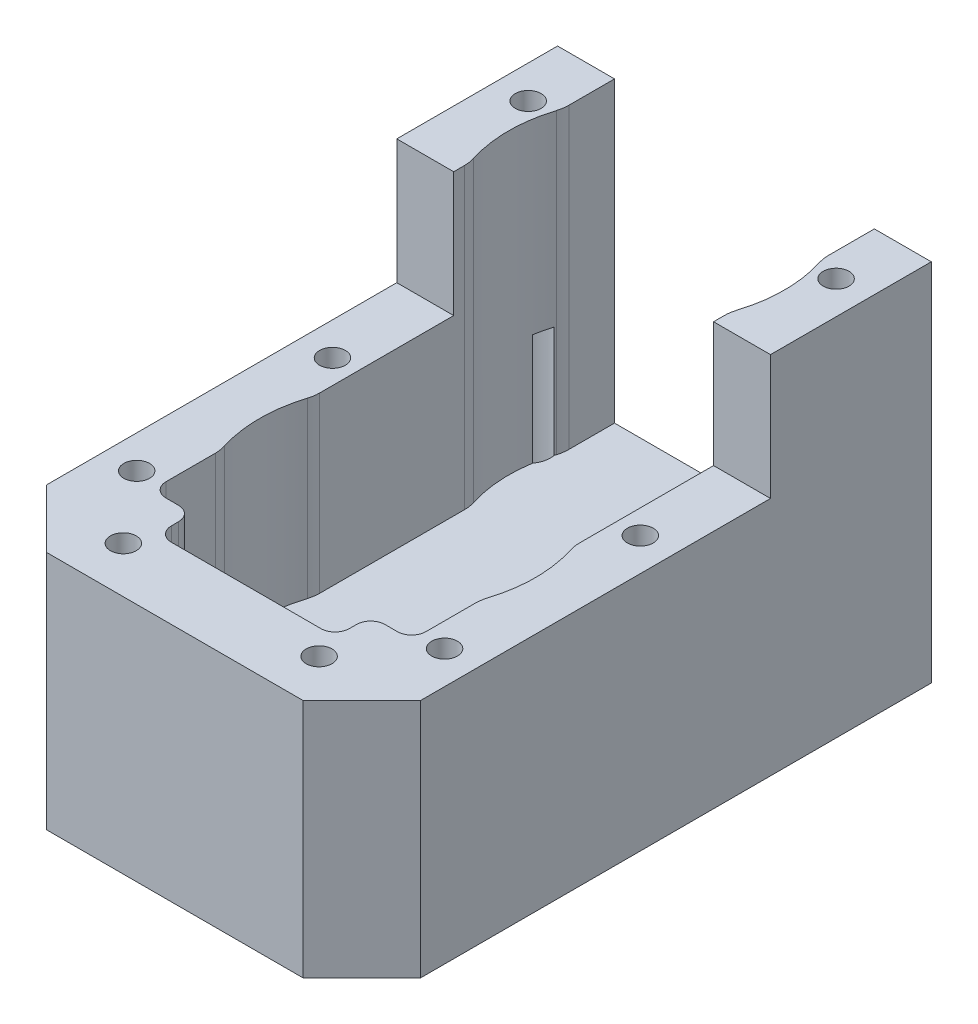
from build123d import *

# Parameters (mm, degrees)
SKETCH1_W                                            = 40
SKETCH1_H                                            = 60
BOSS_EXTRUDE1_DEPTH                                  = 41
M2_5_CLEARANCE_HOLE1_D                               = 2.9
CUT_EXTRUDE1_DEPTH                                   = 33.5
FILLET1_R                                            = 1.6
F_16_0_16_DIAMETER_HOLE2_D                           = 16
SKETCH9_R                                            = 15.5
CUT_EXTRUDE2_DEPTH                                   = 33.5
FILLET2_R                                            = 4
CUT_EXTRUDE3_DEPTH                                   = 65.660652641
CUT_EXTRUDE3_DEPTH_BACK                              = 14
SKETCH11_W                                           = 50.653597067
SKETCH11_H                                           = 53.338920101
SKETCH12_R                                           = 15.5
CUT_EXTRUDE4_DEPTH                                   = 61.185131054
FILLET3_R                                            = 4
BOSS_EXTRUDE3_DEPTH                                  = 3
CHAMFER1_SIZE                                        = 6
BOSS_EXTRUDE4_DEPTH                                  = 41
CUT_EXTRUDE5_DEPTH                                   = 67.715815216
CUT_EXTRUDE5_DEPTH_BACK                              = 67.715815216
SKETCH19_W                                           = 48.667082547
SKETCH19_H                                           = 18.204733745
CBORE_FOR_M2_5_HEX_SOCKET_HEAD_CAP_SCREW_D           = 2.9
CBORE_FOR_M2_5_HEX_SOCKET_HEAD_CAP_SCREW_CBORE_D     = 5
CBORE_FOR_M2_5_HEX_SOCKET_HEAD_CAP_SCREW_CBORE_DEPTH = 20
TAP_DRILL_FOR_M3_HELICOIL1_D                         = 3.2
TAP_DRILL_FOR_M3_HELICOIL1_DEPTH                     = 4
TAP_DRILL_FOR_M3_HELICOIL1_TIP                       = 0.96137699
TAP_DRILL_FOR_M3_HELICOIL2_D                         = 3.15
TAP_DRILL_FOR_M3_HELICOIL2_DEPTH                     = 4.5
TAP_DRILL_FOR_M3_HELICOIL2_TIP                       = 0.946355475


with BuildPart() as part:
    # Sketch1 → Boss-Extrude1 (new body)
    with BuildSketch(Plane(origin=(0, 0, 0), x_dir=(1, 0, 0), z_dir=(0, 1, 0))):
        with Locations((-20, 0)):
            Rectangle(SKETCH1_W, SKETCH1_H)
    extrude(amount=BOSS_EXTRUDE1_DEPTH)

    # M2.5 Clearance Hole1 (through all)
    with Locations(Plane(origin=(0, 41, 0), x_dir=(1, 0, 0), z_dir=(0, 1, 0))):
        with Locations((-37.3, 26), (-37.3, 4), (-37.3, -18), (-31, -25.8), (-9, -25.8), (-2.7, -18), (-2.7, 4), (-2.7, 26)):
            Hole(M2_5_CLEARANCE_HOLE1_D / 2)

    # Sketch4 → Cut-Extrude1 (cut)
    with BuildSketch(Plane(origin=(0, 41, 0), x_dir=(1, 0, 0), z_dir=(0, 1, 0))):
        Polygon((-34.6, 30), (-34.6, -19), (-30, -19), (-30, -23), (-10, -23), (-10, -19), (-5.4, -19), (-5.4, 30), align=None)
    extrude(amount=-CUT_EXTRUDE1_DEPTH, mode=Mode.SUBTRACT)

    # Fillet1
    fillet1_edges = [part.edges().sort_by_distance(p)[0] for p in [
        (-10, 24.25, 23),
        (-30, 24.25, 23),
        (-30, 24.25, 19),
        (-34.6, 24.25, 19),
        (-5.4, 24.25, 19),
        (-10, 24.25, 19),
    ]]
    fillet(fillet1_edges, radius=FILLET1_R)

    # Ø16.0 (16) Diameter Hole2 (through all)
    with Locations(Plane(origin=(0, 7.5, 0), x_dir=(1, 0, 0), z_dir=(0, 1, 0))):
        with Locations((-20, -6)):
            Hole(F_16_0_16_DIAMETER_HOLE2_D / 2)

    # Sketch9 → Cut-Extrude2 (cut)
    with BuildSketch(Plane(origin=(0, 7.5, 0), x_dir=(1, 0, 0), z_dir=(0, 1, 0))):
        with Locations((-20, -6)):
            Circle(SKETCH9_R)
    extrude(amount=CUT_EXTRUDE2_DEPTH, mode=Mode.SUBTRACT)

    # Fillet2
    fillet2_edges = [part.edges().sort_by_distance(p)[0] for p in [
        (-5.4, 24.25, 0.795194528),
        (-5.4, 24.25, 11.204805472),
        (-34.6, 24.25, 11.204805472),
        (-34.6, 24.25, 0.795194528),
    ]]
    fillet(fillet2_edges, radius=FILLET2_R)

    # Sketch11 → Cut-Extrude3 (cut, two sides: drawn at the far end of the back side and taken through both)
    with BuildSketch(Plane(origin=(0, 41, 0), x_dir=(1, 0, 0), z_dir=(0, 1, 0)).offset(-CUT_EXTRUDE3_DEPTH_BACK)):
        with Locations((-19.614312713, -11.741576857)):
            Rectangle(SKETCH11_W, SKETCH11_H)
    extrude(amount=CUT_EXTRUDE3_DEPTH + CUT_EXTRUDE3_DEPTH_BACK, mode=Mode.SUBTRACT)

    # Sketch12 → Cut-Extrude4 (cut, through all)
    with BuildSketch(Plane(origin=(0, 7.5, 0), x_dir=(1, 0, 0), z_dir=(0, 1, 0))):
        with Locations((-20, 22)):
            Circle(SKETCH12_R)
    extrude(amount=CUT_EXTRUDE4_DEPTH, mode=Mode.SUBTRACT)

    # Fillet3
    fillet3_edges = [part.edges().sort_by_distance(p)[0] for p in [
        (-34.6, 24.25, -27.204805472),
        (-5.4, 24.25, -27.204805472),
        (-34.6, 24.25, -16.795194528),
        (-5.4, 24.25, -16.795194528),
    ]]
    fillet(fillet3_edges, radius=FILLET3_R)

    # Sketch15 → Boss-Extrude3 (add)
    with BuildSketch(Plane(origin=(0, 0, -30), x_dir=(-1, 0, 0), z_dir=(0, 0, -1))):
        Polygon((40, 41), (34.6, 41), (34.6, 7.5), (5.4, 7.5), (5.4, 41), (0, 41), (0, 0), (40, 0), align=None)
    extrude(amount=BOSS_EXTRUDE3_DEPTH)

    # Chamfer1
    chamfer1_edges = [part.edges().sort_by_distance(p)[0] for p in [
        (0, 13.5, 30),
        (-40, 13.5, 30),
    ]]
    chamfer(chamfer1_edges, length=CHAMFER1_SIZE)

    # Sketch18 → Boss-Extrude4 (add)
    with BuildSketch(Plane.XZ):
        Polygon((0, 24), (0, -33), (1, -33), (1, 24.414213562), (-5.585786438, 31), (-34.414213562, 31), (-41, 24.414213562), (-41, -33), (-40, -33), (-40, 24), (-34, 30), (-6, 30), align=None)
    extrude(amount=-BOSS_EXTRUDE4_DEPTH)

    # Sketch19 → Cut-Extrude5 (cut, two sides: drawn at the far end of the back side and taken through both)
    with BuildSketch(Plane.ZY.offset(-CUT_EXTRUDE5_DEPTH_BACK)):
        with Locations((9.40565808, 36.102366872)):
            Rectangle(SKETCH19_W, SKETCH19_H)
    extrude(amount=CUT_EXTRUDE5_DEPTH + CUT_EXTRUDE5_DEPTH_BACK, mode=Mode.SUBTRACT)

    # CBORE for M2.5 Hex Socket Head Cap Screw1 (through all)
    with Locations(Plane(origin=(0, 0, 0), x_dir=(-1, 0, 0), z_dir=(0, -1, 0))):
        with Locations((2.7, 4), (37.3, 4), (37.3, -18), (31, -25.8), (9, -25.8), (2.7, -18), (2.7, 26), (37.3, 26)):
            CounterBoreHole(CBORE_FOR_M2_5_HEX_SOCKET_HEAD_CAP_SCREW_D / 2, CBORE_FOR_M2_5_HEX_SOCKET_HEAD_CAP_SCREW_CBORE_D / 2, CBORE_FOR_M2_5_HEX_SOCKET_HEAD_CAP_SCREW_CBORE_DEPTH)

    # Tap Drill for M3 Helicoil1
    with Locations(Plane(origin=(0, 0, -33), x_dir=(-1, 0, 0), z_dir=(0, 0, -1))):
        with Locations((37.8, 35), (8, 3.75), (32, 3.75), (2.2, 35)):
            Hole(TAP_DRILL_FOR_M3_HELICOIL1_D / 2, depth=TAP_DRILL_FOR_M3_HELICOIL1_DEPTH)
            with Locations((0, 0, -(TAP_DRILL_FOR_M3_HELICOIL1_DEPTH + TAP_DRILL_FOR_M3_HELICOIL1_TIP / 2))):  # 118° drill point
                Cone(0, TAP_DRILL_FOR_M3_HELICOIL1_D / 2, TAP_DRILL_FOR_M3_HELICOIL1_TIP, mode=Mode.SUBTRACT)

    # Tap Drill for M3 Helicoil2
    with Locations(Plane.ZY.offset(41)):
        with Locations((7, 6.75), (7, 13.5), (7, 20.25), (-15, 6.75), (-15, 13.5), (-15, 20.25)):
            Hole(TAP_DRILL_FOR_M3_HELICOIL2_D / 2, depth=TAP_DRILL_FOR_M3_HELICOIL2_DEPTH)
            with Locations((0, 0, -(TAP_DRILL_FOR_M3_HELICOIL2_DEPTH + TAP_DRILL_FOR_M3_HELICOIL2_TIP / 2))):  # 118° drill point
                Cone(0, TAP_DRILL_FOR_M3_HELICOIL2_D / 2, TAP_DRILL_FOR_M3_HELICOIL2_TIP, mode=Mode.SUBTRACT)


solid = part.part
